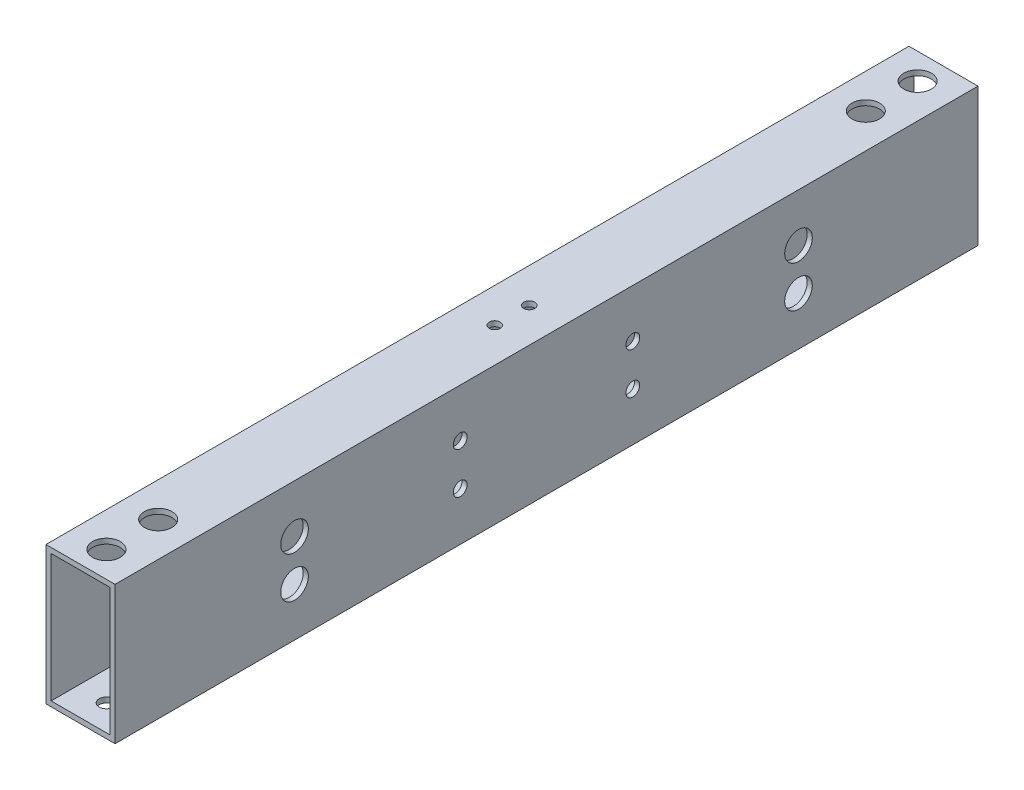
from build123d import *

# Parameters (mm, degrees)
SKETCH_1_W          = 20
SKETCH_1_H          = 40
SKETCH_1_W_2        = 17
SKETCH_1_H_2        = 37
EXTRUDE_1_DEPTH     = 250
SKETCH_2_R          = 2
CUT_EXTRUDE_1_DEPTH = 252.594912508
SKETCH_3_R          = 2.1
CUT_EXTRUDE_2_DEPTH = 254.377189186
SKETCH_4_R          = 1.6
CUT_EXTRUDE_3_DEPTH = 254.377189186
SKETCH_5_R          = 4
CUT_EXTRUDE_4_DEPTH = 10
SKETCH_6_R          = 4
CUT_EXTRUDE_5_DEPTH = 10


with BuildPart() as part:
    # 草图1 → 凸台-拉伸1 (new body)
    with BuildSketch(Plane.XY):
        Rectangle(SKETCH_1_W, SKETCH_1_H)
        Rectangle(SKETCH_1_W_2, SKETCH_1_H_2, mode=Mode.SUBTRACT)
    extrude(amount=-EXTRUDE_1_DEPTH)

    # 草图2 → 切除-拉伸1 (cut, through all)
    with BuildSketch(Plane.ZY.offset(10)):
        with Locations((-100, 6)):
            Circle(SKETCH_2_R)
        with Locations((-52, 6)):
            Circle(SKETCH_2_R)
        with Locations((-52, -6)):
            Circle(SKETCH_2_R)
        with Locations((-100, -6)):
            Circle(SKETCH_2_R)
        with Locations((-150, -6)):
            Circle(SKETCH_2_R)
        with Locations((-198, -6)):
            Circle(SKETCH_2_R)
        with Locations((-198, 6)):
            Circle(SKETCH_2_R)
        with Locations((-150, 6)):
            Circle(SKETCH_2_R)
    extrude(amount=-CUT_EXTRUDE_1_DEPTH, mode=Mode.SUBTRACT)

    # 草图3 → 切除-拉伸2 (cut, through all)
    with BuildSketch(Plane(origin=(0, 20, 0), x_dir=(1, 0, 0), z_dir=(0, 1, 0))):
        with Locations(Location((0, 22.5, 0), (0, 0, 270))):
            Circle(SKETCH_3_R)
        with Locations(Location((0, 7.5, 0), (0, 0, 270))):
            Circle(SKETCH_3_R)
        with Locations(Location((0, 242.5, 0), (0, 0, 270))):
            Circle(SKETCH_3_R)
        with Locations(Location((0, 227.5, 0), (0, 0, 270))):
            Circle(SKETCH_3_R)
    extrude(amount=-CUT_EXTRUDE_2_DEPTH, mode=Mode.SUBTRACT)

    # 草图4 → 切除-拉伸3 (cut, through all)
    with BuildSketch(Plane(origin=(0, 20, 0), x_dir=(1, 0, 0), z_dir=(0, 1, 0))):
        with Locations(Location((0, 130, 0), (0, 0, 270))):
            Circle(SKETCH_4_R)
        with Locations(Location((0, 120, 0), (0, 0, 270))):
            Circle(SKETCH_4_R)
    extrude(amount=-CUT_EXTRUDE_3_DEPTH, mode=Mode.SUBTRACT)

    # 草图5 → 切除-拉伸4 (cut)
    with BuildSketch(Plane(origin=(0, 20, 0), x_dir=(1, 0, 0), z_dir=(0, 1, 0))):
        with Locations(Location((0, 22.5, 0), (0, 0, 270))):
            Circle(SKETCH_5_R)
        with Locations(Location((0, 7.5, 0), (0, 0, 270))):
            Circle(SKETCH_5_R)
        with Locations(Location((0, 242.5, 0), (0, 0, 270))):
            Circle(SKETCH_5_R)
        with Locations(Location((0, 227.5, 0), (0, 0, 270))):
            Circle(SKETCH_5_R)
    extrude(amount=-CUT_EXTRUDE_4_DEPTH, mode=Mode.SUBTRACT)

    # 草图6 → 切除-拉伸5 (cut)
    with BuildSketch(Plane(origin=(10, 0, 0), x_dir=(0, 0, -1), z_dir=(1, 0, 0))):
        with Locations((52, 6)):
            Circle(SKETCH_6_R)
        with Locations((52, -6)):
            Circle(SKETCH_6_R)
        with Locations((198, 6)):
            Circle(SKETCH_6_R)
        with Locations((198, -6)):
            Circle(SKETCH_6_R)
    extrude(amount=-CUT_EXTRUDE_5_DEPTH, mode=Mode.SUBTRACT)


solid = part.part
